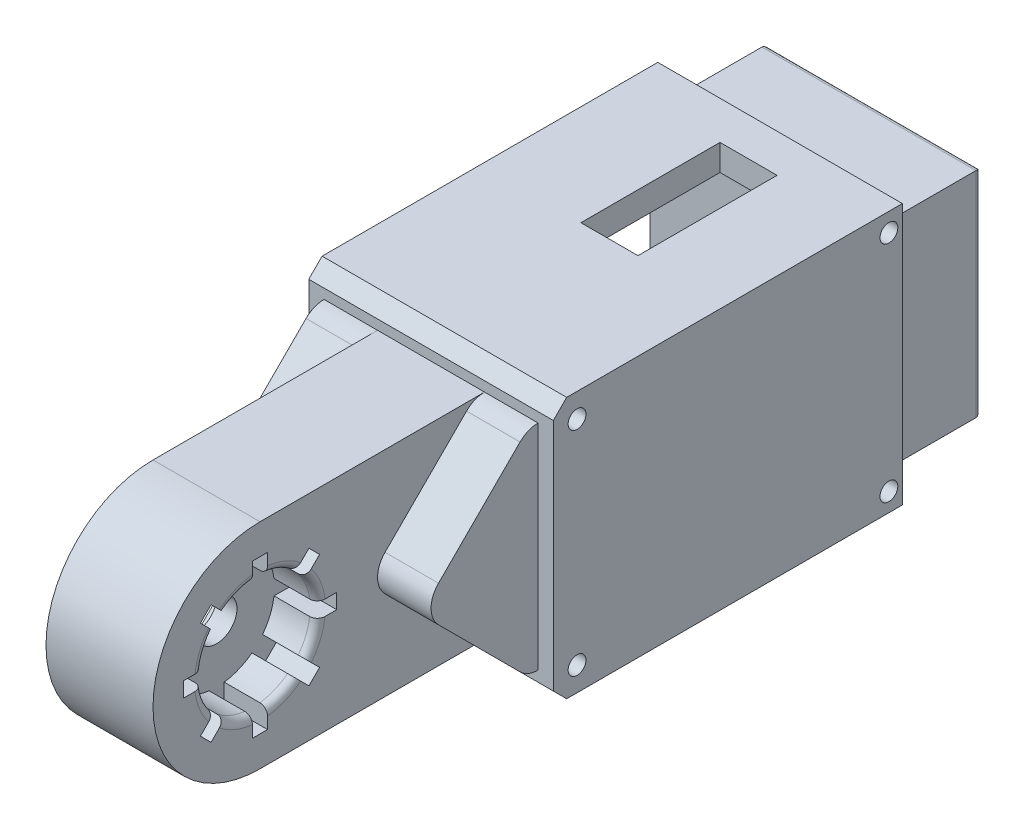
from build123d import *

# Parameters (mm, degrees)
SKETCH2_W                = 42
SKETCH2_H                = 42
BOSS_EXTRUDE1_DEPTH      = 89
SKETCH3_W                = 21
SKETCH3_H                = 42
BOSS_EXTRUDE2_DEPTH      = 42
BOSS_EXTRUDE3_DEPTH      = 21
SKETCH9_R                = 11.35
CUT_EXTRUDE2_DEPTH       = 8.5
CUT_EXTRUDE3_START       = -8.5
SKETCH11_R               = 11.35
CUT_EXTRUDE3_DEPTH       = 8.5
SKETCH12_R               = 3.975
CUT_EXTRUDE4_DEPTH       = 156.157984003
BOSS_EXTRUDE4_DEPTH      = 10.5
BOSS_EXTRUDE4_DEPTH_BACK = 31.5
FILLET1_R                = 5
FILLET2_R                = 5
FILLET3_R                = 5
FILLET4_R                = 5
FILLET5_R                = 5
FILLET6_R                = 5
FILLET7_R                = 1.5
FILLET8_R                = 1.5
SKETCH21_W               = 2.95860585
SKETCH21_H               = 4.417
CUT_EXTRUDE5_DEPTH       = 8.5
CIRPATTERN2_COUNT        = 8
MIRROR1_COPY_1_SKETCH_W  = 2.95860585
MIRROR1_COPY_1_SKETCH_H  = 4.417
MIRROR1_COPY_1_DEPTH     = 8.5
MIRROR1_COPY_2_SKETCH_W  = 2.95860585
MIRROR1_COPY_2_SKETCH_H  = 4.417
MIRROR1_COPY_2_DEPTH     = 8.5
MIRROR1_COPY_3_SKETCH_W  = 2.95860585
MIRROR1_COPY_3_SKETCH_H  = 4.417
MIRROR1_COPY_3_DEPTH     = 8.5
MIRROR1_COPY_4_SKETCH_W  = 2.95860585
MIRROR1_COPY_4_SKETCH_H  = 4.417
MIRROR1_COPY_4_DEPTH     = 8.5
MIRROR1_COPY_5_SKETCH_W  = 2.95860585
MIRROR1_COPY_5_SKETCH_H  = 4.417
MIRROR1_COPY_5_DEPTH     = 8.5
MIRROR1_COPY_6_SKETCH_W  = 2.95860585
MIRROR1_COPY_6_SKETCH_H  = 4.417
MIRROR1_COPY_6_DEPTH     = 8.5
MIRROR1_COPY_7_SKETCH_W  = 2.95860585
MIRROR1_COPY_7_SKETCH_H  = 4.417
MIRROR1_COPY_7_DEPTH     = 8.5
SKETCH24_W               = 86.928932188
SKETCH24_H               = 4.545220174
SKETCH24_H_2             = 4.689106432
BOSS_EXTRUDE6_DEPTH      = 42
SKETCH25_W               = 68.5
SKETCH25_H               = 51.234326606
BOSS_EXTRUDE7_DEPTH      = 3
SKETCH28_W               = 68.5
SKETCH28_H               = 51.234326606
BOSS_EXTRUDE8_DEPTH      = 3
SKETCH30_W               = 62
SKETCH30_H               = 41.004326606
CUT_EXTRUDE6_DEPTH       = 45
SKETCH31_W               = 18.428932188
SKETCH31_H               = 4.615
CUT_EXTRUDE7_DEPTH       = 161.589321529
CHAMFER1_SIZE            = 1.5
SKETCH32_W               = 30
SKETCH32_H               = 30
CUT_EXTRUDE8_DEPTH       = 15
SKETCH33_R               = 5
CUT_EXTRUDE9_DEPTH       = 16.8
CUT_EXTRUDE10_DEPTH      = 162.455660134
CHAMFER2_SIZE            = 6
CHAMFER3_SIZE            = 6
CHAMFER4_SIZE            = 6
CHAMFER5_SIZE            = 6
SKETCH35_R               = 1.75
CUT_EXTRUDE11_DEPTH      = 162.455660134
SKETCH38_W               = 11.2
SKETCH38_H               = 27.3
CUT_EXTRUDE12_DEPTH      = 163.188027372
FILLET9_R                = 1
FILLET10_R               = 1


with BuildPart() as part:
    # Sketch2 → Boss-Extrude1 (new body)
    with BuildSketch(Plane.XY):
        Rectangle(SKETCH2_W, SKETCH2_H)
    extrude(amount=BOSS_EXTRUDE1_DEPTH)

    # Sketch3 → Boss-Extrude2 (add)
    with BuildSketch(Plane.XY.offset(89)):
        Rectangle(SKETCH3_W, SKETCH3_H)
    extrude(amount=BOSS_EXTRUDE2_DEPTH)

    # Sketch8 → Boss-Extrude3 (add)
    with BuildSketch(Plane.ZY.offset(10.5)):
        with BuildLine():
            Line((131, 21), (131, -21))
            ThreePointArc((131, -21), (152, 0), (131, 21))
        make_face()
    extrude(amount=-BOSS_EXTRUDE3_DEPTH)

    # Sketch9 → Cut-Extrude2 (cut)
    with BuildSketch(Plane.ZY.offset(10.5)):
        with Locations((131, 0)):
            Circle(SKETCH9_R)
    extrude(amount=-CUT_EXTRUDE2_DEPTH, mode=Mode.SUBTRACT)

    # Sketch11 → Cut-Extrude3 (cut)
    with BuildSketch(Plane(origin=(10.5, 0, 0), x_dir=(0, 0, -1), z_dir=(1, 0, 0)).offset(CUT_EXTRUDE3_START)):
        with Locations(Location((-131, 0, 0), (0, 0, 180))):
            Circle(SKETCH11_R)
    extrude(amount=CUT_EXTRUDE3_DEPTH, mode=Mode.SUBTRACT)

    # Sketch12 → Cut-Extrude4 (cut, through all)
    with BuildSketch(Plane.ZY.offset(2)):
        with Locations((131, 0)):
            Circle(SKETCH12_R)
    extrude(amount=-CUT_EXTRUDE4_DEPTH, mode=Mode.SUBTRACT)

    # Sketch20 → Boss-Extrude4 (add, two sides: drawn at the far end of the back side and taken through both)
    with BuildSketch(Plane.ZY.offset(10.5).offset(-BOSS_EXTRUDE4_DEPTH_BACK)):
        Polygon((89, 21), (110, 0), (89, -21), align=None)
    extrude(amount=BOSS_EXTRUDE4_DEPTH + BOSS_EXTRUDE4_DEPTH_BACK)

    # Fillet1
    fillet1_edges = [part.edges().sort_by_distance(p)[0] for p in [
        (15.75, 0, 110),
    ]]
    fillet(fillet1_edges, radius=FILLET1_R)

    # Fillet2
    fillet2_edges = [part.edges().sort_by_distance(p)[0] for p in [
        (-15.75, 0, 110),
    ]]
    fillet(fillet2_edges, radius=FILLET2_R)

    # Fillet3
    fillet3_edges = [part.edges().sort_by_distance(p)[0] for p in [
        (-15.75, -21, 89),
    ]]
    fillet(fillet3_edges, radius=FILLET3_R)

    # Fillet4
    fillet4_edges = [part.edges().sort_by_distance(p)[0] for p in [
        (-15.75, 21, 89),
    ]]
    fillet(fillet4_edges, radius=FILLET4_R)

    # Fillet5
    fillet5_edges = [part.edges().sort_by_distance(p)[0] for p in [
        (15.75, -21, 89),
    ]]
    fillet(fillet5_edges, radius=FILLET5_R)

    # Fillet6
    fillet6_edges = [part.edges().sort_by_distance(p)[0] for p in [
        (15.75, 21, 89),
    ]]
    fillet(fillet6_edges, radius=FILLET6_R)

    # Fillet7
    fillet7_edges = [part.edges().sort_by_distance(p)[0] for p in [
        (-10.5, 0, 119.65),
    ]]
    fillet(fillet7_edges, radius=FILLET7_R)

    # Fillet8
    fillet8_edges = [part.edges().sort_by_distance(p)[0] for p in [
        (10.5, 0, 119.65),
    ]]
    fillet(fillet8_edges, radius=FILLET8_R)

    # Sketch21 → Cut-Extrude5 (cut)
    with BuildSketch(Plane.ZY.offset(10.5)):
        with Locations((131, 12.85)):
            Rectangle(SKETCH21_W, SKETCH21_H)
    cut_extrude5 = extrude(amount=-CUT_EXTRUDE5_DEPTH, mode=Mode.SUBTRACT)

    # CirPattern2: Cut-Extrude5 ×8 about axis
    cirpattern2_axis = Axis((0, 0, 131), (1, 0, 0))
    for i in range(1, CIRPATTERN2_COUNT):
        add(cut_extrude5.rotate(cirpattern2_axis, i * 360 / CIRPATTERN2_COUNT), mode=Mode.SUBTRACT)

    # Mirror1: Cut-Extrude5 across plane
    add(cut_extrude5.mirror(Plane(origin=(0, 0, 0), x_dir=(0, 0, 1), z_dir=(1, 0, 0))), mode=Mode.SUBTRACT)

    # Mirror1 copy 1 sketch → Mirror1 copy 1 (cut)
    with BuildSketch(Plane(origin=(10.5, 92.630988335, 38.369011665), x_dir=(0, -0.7071067811865475, 0.7071067811865476), z_dir=(1, 0, 0))):
        with Locations((131, -12.85)):
            Rectangle(MIRROR1_COPY_1_SKETCH_W, MIRROR1_COPY_1_SKETCH_H)
    extrude(amount=-MIRROR1_COPY_1_DEPTH, mode=Mode.SUBTRACT)

    # Mirror1 copy 2 sketch → Mirror1 copy 2 (cut)
    with BuildSketch(Plane(origin=(10.5, 131, 131), x_dir=(0, -1, 0), z_dir=(1, 0, 0))):
        with Locations((131, -12.85)):
            Rectangle(MIRROR1_COPY_2_SKETCH_W, MIRROR1_COPY_2_SKETCH_H)
    extrude(amount=-MIRROR1_COPY_2_DEPTH, mode=Mode.SUBTRACT)

    # Mirror1 copy 3 sketch → Mirror1 copy 3 (cut)
    with BuildSketch(Plane(origin=(10.5, 92.630988335, 223.630988335), x_dir=(0, -0.7071067811865476, -0.7071067811865475), z_dir=(1, 0, 0))):
        with Locations((131, -12.85)):
            Rectangle(MIRROR1_COPY_3_SKETCH_W, MIRROR1_COPY_3_SKETCH_H)
    extrude(amount=-MIRROR1_COPY_3_DEPTH, mode=Mode.SUBTRACT)

    # Mirror1 copy 4 sketch → Mirror1 copy 4 (cut)
    with BuildSketch(Plane(origin=(10.5, 0, 262), x_dir=(0, 0, -1), z_dir=(1, 0, 0))):
        with Locations((131, -12.85)):
            Rectangle(MIRROR1_COPY_4_SKETCH_W, MIRROR1_COPY_4_SKETCH_H)
    extrude(amount=-MIRROR1_COPY_4_DEPTH, mode=Mode.SUBTRACT)

    # Mirror1 copy 5 sketch → Mirror1 copy 5 (cut)
    with BuildSketch(Plane(origin=(10.5, -92.630988335, 223.630988335), x_dir=(0, 0.7071067811865475, -0.7071067811865477), z_dir=(1, 0, 0))):
        with Locations((131, -12.85)):
            Rectangle(MIRROR1_COPY_5_SKETCH_W, MIRROR1_COPY_5_SKETCH_H)
    extrude(amount=-MIRROR1_COPY_5_DEPTH, mode=Mode.SUBTRACT)

    # Mirror1 copy 6 sketch → Mirror1 copy 6 (cut)
    with BuildSketch(Plane(origin=(10.5, -131, 131), x_dir=(0, 1, 0), z_dir=(1, 0, 0))):
        with Locations((131, -12.85)):
            Rectangle(MIRROR1_COPY_6_SKETCH_W, MIRROR1_COPY_6_SKETCH_H)
    extrude(amount=-MIRROR1_COPY_6_DEPTH, mode=Mode.SUBTRACT)

    # Mirror1 copy 7 sketch → Mirror1 copy 7 (cut)
    with BuildSketch(Plane(origin=(10.5, -92.630988335, 38.369011665), x_dir=(0, 0.7071067811865477, 0.7071067811865474), z_dir=(1, 0, 0))):
        with Locations((131, -12.85)):
            Rectangle(MIRROR1_COPY_7_SKETCH_W, MIRROR1_COPY_7_SKETCH_H)
    extrude(amount=-MIRROR1_COPY_7_DEPTH, mode=Mode.SUBTRACT)

    # Sketch24 → Boss-Extrude6 (add)
    with BuildSketch(Plane(origin=(21, 0, 0), x_dir=(0, 0, -1), z_dir=(1, 0, 0))):
        with Locations((-43.464466094, 23.272610087)):
            Rectangle(SKETCH24_W, SKETCH24_H)
        with Locations((-43.464466094, -23.344553216)):
            Rectangle(SKETCH24_W, SKETCH24_H_2)
    extrude(amount=-BOSS_EXTRUDE6_DEPTH)

    # Sketch25 → Boss-Extrude7 (add)
    with BuildSketch(Plane(origin=(21, 0, 0), x_dir=(0, 0, -1), z_dir=(1, 0, 0))):
        with Locations((-52.678932188, -0.071943129)):
            Rectangle(SKETCH25_W, SKETCH25_H)
    extrude(amount=BOSS_EXTRUDE7_DEPTH)

    # Sketch28 → Boss-Extrude8 (add)
    with BuildSketch(Plane.ZY.offset(21)):
        with Locations((52.678932188, -0.071943129)):
            Rectangle(SKETCH28_W, SKETCH28_H)
    extrude(amount=BOSS_EXTRUDE8_DEPTH)

    # Sketch30 → Cut-Extrude6 (cut)
    with BuildSketch(Plane.ZY.offset(24)):
        with Locations((50.928932188, -0.071943129)):
            Rectangle(SKETCH30_W, SKETCH30_H)
    extrude(amount=-CUT_EXTRUDE6_DEPTH, mode=Mode.SUBTRACT)

    # Sketch31 → Cut-Extrude7 (cut, through all)
    with BuildSketch(Plane(origin=(21, 0, 0), x_dir=(0, 0, -1), z_dir=(1, 0, 0))):
        with Locations((-9.214466094, -23.381606432)):
            Rectangle(SKETCH31_W, SKETCH31_H)
        with Locations((-9.214466094, 23.237720174)):
            Rectangle(SKETCH31_W, SKETCH31_H)
    extrude(amount=-CUT_EXTRUDE7_DEPTH, mode=Mode.SUBTRACT)

    # Chamfer1
    chamfer1_edges = [part.edges().sort_by_distance(p)[0] for p in [
        (-21, -0.071943129, 18.428932188),
        (21, -0.071943129, 18.428932188),
        (0, -21.074106432, 18.428932188),
        (0, 20.930220174, 18.428932188),
    ]]
    chamfer(chamfer1_edges, length=CHAMFER1_SIZE)

    # Sketch32 → Cut-Extrude8 (cut)
    with BuildSketch(Plane(origin=(0, 0, 0), x_dir=(-1, 0, 0), z_dir=(0, 0, -1))):
        Rectangle(SKETCH32_W, SKETCH32_H)
    extrude(amount=-CUT_EXTRUDE8_DEPTH, mode=Mode.SUBTRACT)

    # Sketch33 → Cut-Extrude9 (cut)
    with BuildSketch(Plane.XY.offset(19.928932188)):
        Circle(SKETCH33_R)
    extrude(amount=-CUT_EXTRUDE9_DEPTH, mode=Mode.SUBTRACT)

    # Sketch34 → Cut-Extrude10 (cut, through all)
    with BuildSketch(Plane.ZY.offset(24)):
        Polygon((88.330412389, -21.669587611), (88.330412389, -28.222069099), (81.777930901, -28.222069099), align=None)
        Polygon((88.330412389, 28.078182842), (81.777930901, 28.078182842), (88.330412389, 21.525701354), align=None)
    extrude(amount=-CUT_EXTRUDE10_DEPTH, mode=Mode.SUBTRACT)

    # Chamfer2
    chamfer2_edges = [part.edges().sort_by_distance(p)[0] for p in [
        (-1.5, 20.430220174, 81.928932188),
    ]]
    chamfer(chamfer2_edges, length=CHAMFER2_SIZE)

    # Chamfer3
    chamfer3_edges = [part.edges().sort_by_distance(p)[0] for p in [
        (-1.5, -20.574106432, 81.928932188),
    ]]
    chamfer(chamfer3_edges, length=CHAMFER3_SIZE)

    # Chamfer4
    chamfer4_edges = [part.edges().sort_by_distance(p)[0] for p in [
        (-1.5, 20.430220174, 19.928932188),
    ]]
    chamfer(chamfer4_edges, length=CHAMFER4_SIZE)

    # Chamfer5
    chamfer5_edges = [part.edges().sort_by_distance(p)[0] for p in [
        (-1.5, -20.574106432, 19.928932188),
    ]]
    chamfer(chamfer5_edges, length=CHAMFER5_SIZE)

    # Sketch35 → Cut-Extrude11 (cut, through all)
    with BuildSketch(Plane.ZY.offset(24)):
        with Locations(Location((21.074129387, 21.904762541, 0), (0, 0, 270))):
            Circle(SKETCH35_R)
        with Locations(Location((82.274422533, 20.83321052, 0), (0, 0, 270))):
            Circle(SKETCH35_R)
        with Locations(Location((82.274422533, -20.977096777, 0), (0, 0, 270))):
            Circle(SKETCH35_R)
        with Locations(Location((21.073965823, -22.048529957, 0), (0, 0, 270))):
            Circle(SKETCH35_R)
    extrude(amount=-CUT_EXTRUDE11_DEPTH, mode=Mode.SUBTRACT)

    # Sketch38 → Cut-Extrude12 (cut, through all)
    with BuildSketch(Plane(origin=(0, -25.689106432, 0), x_dir=(-1, 0, 0), z_dir=(0, -1, 0))):
        with Locations((-1.30782555, -39.578932188)):
            Rectangle(SKETCH38_W, SKETCH38_H)
    extrude(amount=-CUT_EXTRUDE12_DEPTH, mode=Mode.SUBTRACT)

    # Fillet9
    fillet9_edges = [part.edges().sort_by_distance(p)[0] for p in [
        (21, -0.071943129, 0),
        (-21, -0.071943129, 0),
        (0, -21.074106432, 0),
        (0, 20.930220174, 0),
    ]]
    fillet(fillet9_edges, radius=FILLET9_R)

    # Fillet10
    fillet10_edges = [part.edges().sort_by_distance(p)[0] for p in [
        (15, 0, 0),
        (0, -15, 0),
        (-15, 0, 0),
        (0, 15, 0),
    ]]
    fillet(fillet10_edges, radius=FILLET10_R)


solid = part.part
